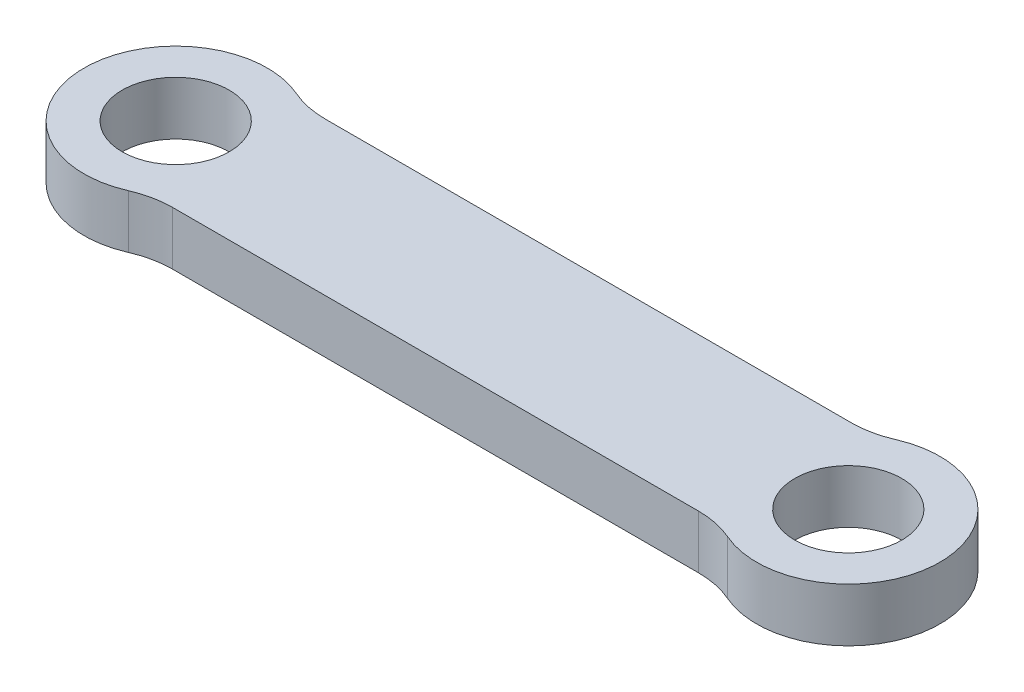
from build123d import *

# Parameters (mm, degrees)
SKETCH1_R           = 1.75
BOSS_EXTRUDE1_DEPTH = 1.75
FILLET1_R           = 3


with BuildPart() as part:
    # Sketch1 → Boss-Extrude1 (new body)
    with BuildSketch(Plane(origin=(0, 0, 0), x_dir=(1, 0, 0), z_dir=(0, 1, 0))):
        with BuildLine():
            ThreePointArc((1.658312395, 2.5), (-3, 0), (1.658312395, -2.5))
            Line((1.658312395, -2.5), (20.341687605, -2.5))
            ThreePointArc((20.341687605, -2.5), (25, 0), (20.341687605, 2.5))
            Line((20.341687605, 2.5), (1.658312395, 2.5))
        make_face()
        with Locations(Location((0, 0, 0), (0, 0, 270))):
            Circle(SKETCH1_R, mode=Mode.SUBTRACT)
        with Locations(Location((22, 0, 0), (0, 0, 270))):
            Circle(SKETCH1_R, mode=Mode.SUBTRACT)
    extrude(amount=BOSS_EXTRUDE1_DEPTH)

    # Fillet1
    fillet1_edges = [part.edges().sort_by_distance(p)[0] for p in [
        (20.341687605, 0.875, 2.5),
        (1.658312395, 0.875, 2.5),
        (1.658312395, 0.875, -2.5),
        (20.341687605, 0.875, -2.5),
    ]]
    fillet(fillet1_edges, radius=FILLET1_R)


solid = part.part
